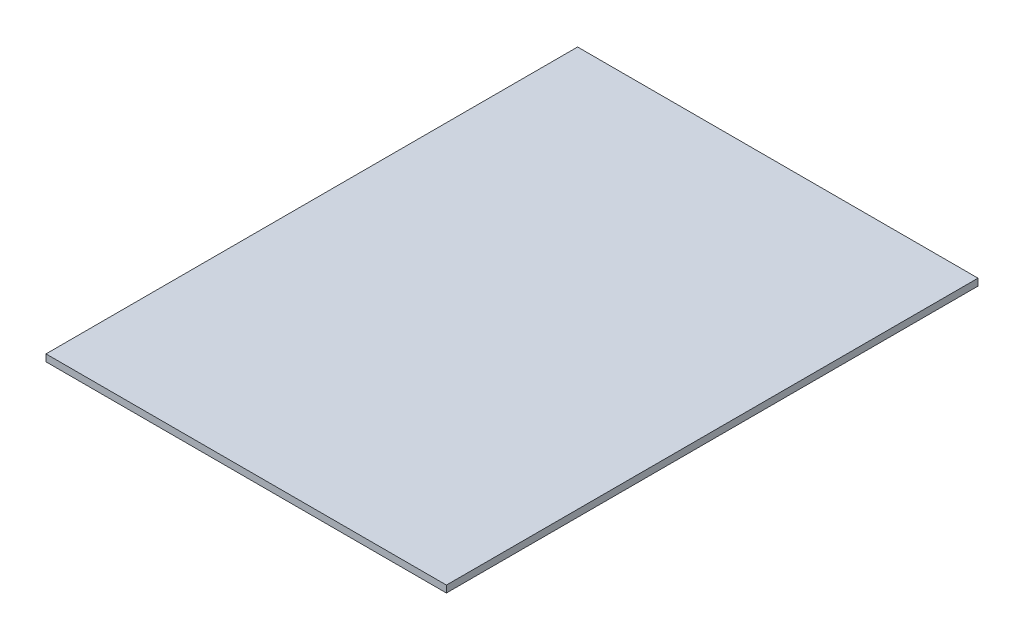
from build123d import *

# Parameters (mm, degrees)
SKETCH_1_W      = 58
SKETCH_1_H      = 77
EXTRUDE_1_DEPTH = 1


with BuildPart() as part:
    # Эскиз1 → Бобышка-Вытянуть1 (new body)
    with BuildSketch(Plane(origin=(0, 0, 0), x_dir=(1, 0, 0), z_dir=(0, 1, 0))):
        Rectangle(SKETCH_1_W, SKETCH_1_H)
    extrude(amount=EXTRUDE_1_DEPTH)


solid = part.part
